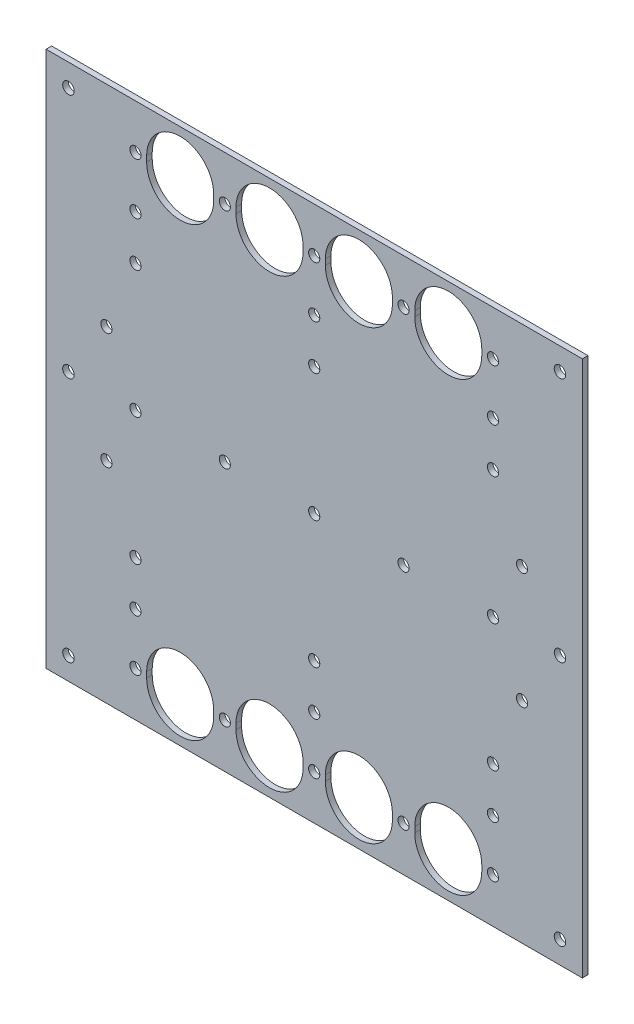
from build123d import *

# Parameters (mm, degrees)
SKETCH1_W           = 304.8
SKETCH1_H           = 304.8
SKETCH1_R           = 3.175
SKETCH1_R_2         = 3.2639
BOSS_EXTRUDE1_DEPTH = 3.175


with BuildPart() as part:
    # Sketch1 → Boss-Extrude1 (new body)
    with BuildSketch(Plane.XY):
        Rectangle(SKETCH1_W, SKETCH1_H)
        with Locations((-101.6, 0)):
            Circle(SKETCH1_R, mode=Mode.SUBTRACT)
        with Locations((-50.8, 0)):
            Circle(SKETCH1_R, mode=Mode.SUBTRACT)
        Circle(SKETCH1_R, mode=Mode.SUBTRACT)
        with Locations((101.6, 0)):
            Circle(SKETCH1_R, mode=Mode.SUBTRACT)
        with Locations((50.8, 0)):
            Circle(SKETCH1_R, mode=Mode.SUBTRACT)
        with Locations((-50.8, 127)):
            Circle(SKETCH1_R, mode=Mode.SUBTRACT)
        with Locations((0, 127)):
            Circle(SKETCH1_R, mode=Mode.SUBTRACT)
        with Locations((50.8, 127)):
            Circle(SKETCH1_R, mode=Mode.SUBTRACT)
        with Locations((-101.6, 72.39)):
            Circle(SKETCH1_R, mode=Mode.SUBTRACT)
        with Locations((0, 72.39)):
            Circle(SKETCH1_R, mode=Mode.SUBTRACT)
        with Locations((101.6, 72.39)):
            Circle(SKETCH1_R, mode=Mode.SUBTRACT)
        with Locations((-101.6, -72.39)):
            Circle(SKETCH1_R, mode=Mode.SUBTRACT)
        with Locations((0, -72.39)):
            Circle(SKETCH1_R, mode=Mode.SUBTRACT)
        with Locations((101.6, -72.39)):
            Circle(SKETCH1_R, mode=Mode.SUBTRACT)
        with Locations((50.8, -127)):
            Circle(SKETCH1_R, mode=Mode.SUBTRACT)
        with Locations((0, -127)):
            Circle(SKETCH1_R, mode=Mode.SUBTRACT)
        with Locations((-50.8, -127)):
            Circle(SKETCH1_R, mode=Mode.SUBTRACT)
        with Locations((-101.6, 97.79)):
            Circle(SKETCH1_R, mode=Mode.SUBTRACT)
        with Locations((0, 97.79)):
            Circle(SKETCH1_R, mode=Mode.SUBTRACT)
        with Locations((101.6, 97.79)):
            Circle(SKETCH1_R, mode=Mode.SUBTRACT)
        with Locations((101.6, 127)):
            Circle(SKETCH1_R, mode=Mode.SUBTRACT)
        with Locations((-101.6, 127)):
            Circle(SKETCH1_R, mode=Mode.SUBTRACT)
        with Locations((-118.11, 33.02)):
            Circle(SKETCH1_R, mode=Mode.SUBTRACT)
        with Locations((-101.6, -127)):
            Circle(SKETCH1_R, mode=Mode.SUBTRACT)
        with Locations((101.6, -127)):
            Circle(SKETCH1_R, mode=Mode.SUBTRACT)
        with Locations((101.6, -97.79)):
            Circle(SKETCH1_R, mode=Mode.SUBTRACT)
        with Locations((0, -97.79)):
            Circle(SKETCH1_R, mode=Mode.SUBTRACT)
        with Locations((-101.6, -97.79)):
            Circle(SKETCH1_R, mode=Mode.SUBTRACT)
        with Locations((-118.11, -33.02)):
            Circle(SKETCH1_R, mode=Mode.SUBTRACT)
        with Locations((-139.7, 139.7)):
            Circle(SKETCH1_R_2, mode=Mode.SUBTRACT)
        with Locations((-139.7, 0)):
            Circle(SKETCH1_R_2, mode=Mode.SUBTRACT)
        with Locations((-139.7, -139.7)):
            Circle(SKETCH1_R_2, mode=Mode.SUBTRACT)
        with Locations((139.7, -139.7)):
            Circle(SKETCH1_R_2, mode=Mode.SUBTRACT)
        with Locations((139.7, 0)):
            Circle(SKETCH1_R_2, mode=Mode.SUBTRACT)
        with Locations((139.7, 139.7)):
            Circle(SKETCH1_R_2, mode=Mode.SUBTRACT)
        with Locations((118.11, 33.02)):
            Circle(SKETCH1_R, mode=Mode.SUBTRACT)
        with Locations((118.11, -33.02)):
            Circle(SKETCH1_R, mode=Mode.SUBTRACT)
        with BuildLine():
            Line((-95.25, 125.4125), (-95.25, 128.5875))
            ThreePointArc((-95.25, 128.5875), (-76.2, 147.6375), (-57.15, 128.5875))
            Line((-57.15, 128.5875), (-57.15, 125.4125))
            ThreePointArc((-57.15, 125.4125), (-76.2, 106.3625), (-95.25, 125.4125))
        make_face(mode=Mode.SUBTRACT)
        with BuildLine():
            Line((-6.35, 125.4125), (-6.35, 128.5875))
            ThreePointArc((-6.35, 128.5875), (-25.4, 147.6375), (-44.45, 128.5875))
            Line((-44.45, 128.5875), (-44.45, 125.4125))
            ThreePointArc((-44.45, 125.4125), (-25.4, 106.3625), (-6.35, 125.4125))
        make_face(mode=Mode.SUBTRACT)
        with BuildLine():
            Line((6.35, 125.4125), (6.35, 128.5875))
            ThreePointArc((6.35, 128.5875), (25.4, 147.6375), (44.45, 128.5875))
            Line((44.45, 128.5875), (44.45, 125.4125))
            ThreePointArc((44.45, 125.4125), (25.4, 106.3625), (6.35, 125.4125))
        make_face(mode=Mode.SUBTRACT)
        with BuildLine():
            Line((95.25, 125.4125), (95.25, 128.5875))
            ThreePointArc((95.25, 128.5875), (76.2, 147.6375), (57.15, 128.5875))
            Line((57.15, 128.5875), (57.15, 125.4125))
            ThreePointArc((57.15, 125.4125), (76.2, 106.3625), (95.25, 125.4125))
        make_face(mode=Mode.SUBTRACT)
        with BuildLine():
            Line((-95.25, -125.4125), (-95.25, -128.5875))
            ThreePointArc((-95.25, -128.5875), (-76.2, -147.6375), (-57.15, -128.5875))
            Line((-57.15, -128.5875), (-57.15, -125.4125))
            ThreePointArc((-57.15, -125.4125), (-76.2, -106.3625), (-95.25, -125.4125))
        make_face(mode=Mode.SUBTRACT)
        with BuildLine():
            Line((-6.35, -125.4125), (-6.35, -128.5875))
            ThreePointArc((-6.35, -128.5875), (-25.4, -147.6375), (-44.45, -128.5875))
            Line((-44.45, -128.5875), (-44.45, -125.4125))
            ThreePointArc((-44.45, -125.4125), (-25.4, -106.3625), (-6.35, -125.4125))
        make_face(mode=Mode.SUBTRACT)
        with BuildLine():
            Line((6.35, -125.4125), (6.35, -128.5875))
            ThreePointArc((6.35, -128.5875), (25.4, -147.6375), (44.45, -128.5875))
            Line((44.45, -128.5875), (44.45, -125.4125))
            ThreePointArc((44.45, -125.4125), (25.4, -106.3625), (6.35, -125.4125))
        make_face(mode=Mode.SUBTRACT)
        with BuildLine():
            Line((95.25, -125.4125), (95.25, -128.5875))
            ThreePointArc((95.25, -128.5875), (76.2, -147.6375), (57.15, -128.5875))
            Line((57.15, -128.5875), (57.15, -125.4125))
            ThreePointArc((57.15, -125.4125), (76.2, -106.3625), (95.25, -125.4125))
        make_face(mode=Mode.SUBTRACT)
    extrude(amount=BOSS_EXTRUDE1_DEPTH)


solid = part.part
